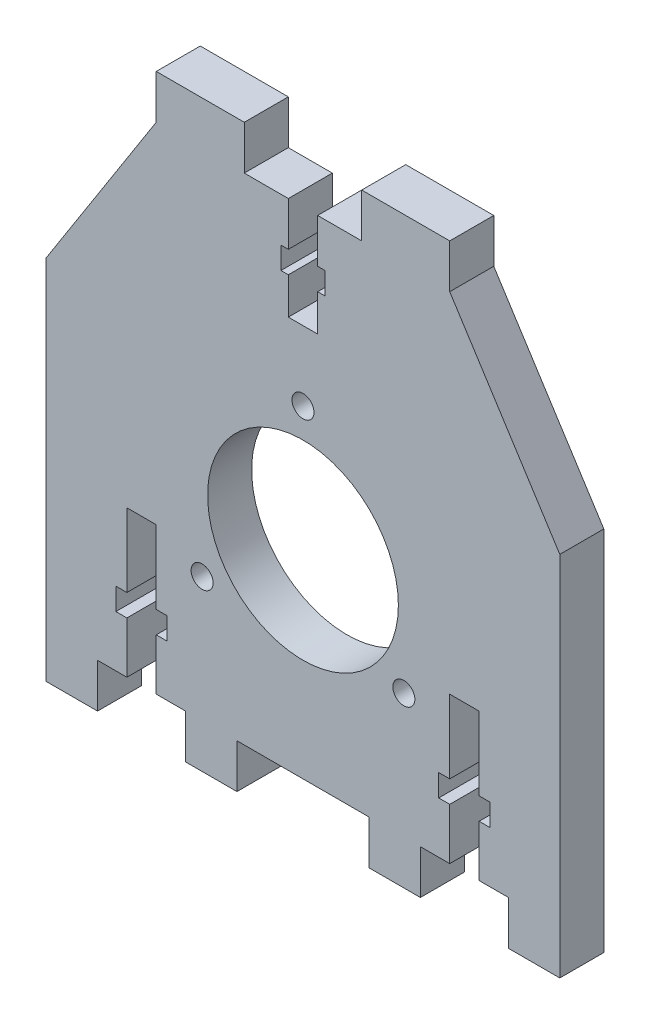
from build123d import *

# Parameters (mm, degrees)
ESQUISSE1_R             = 13
BOSS_EXTRU_1_DEPTH      = 6
ESQUISSE2_W             = 12
ESQUISSE2_H             = 6
BOSS_EXTRU_2_DEPTH      = 6
ESQUISSE3_R             = 1.5
ENL_V_MAT_EXTRU_1_DEPTH = 10
ENL_V_MAT_EXTRU_2_DEPTH = 10


with BuildPart() as part:
    # Esquisse1 → Boss.-Extru.1 (new body)
    with BuildSketch(Plane.XY):
        Polygon((55, 13), (53.5, 13), (53.5, 16), (55, 16), (55, 26), (59, 26), (59, 16), (60.5, 16), (60.5, 13), (59, 13), (59, 6), (63, 6), (63, 0), (70, 0), (70, 50), (55, 73.5), (15, 73.5), (0, 50), (0, 0), (7, 0), (7, 6), (11, 6), (11, 13), (9.5, 13), (9.5, 16), (11, 16), (11, 26), (15, 26), (15, 16), (16.5, 16), (16.5, 13), (15, 13), (15, 6), (19, 6), (19, 0), (26, 0), (26, 6), (44, 6), (44, 0), (51, 0), (51, 6), (55, 6), align=None)
        with Locations((35, 33)):
            Circle(ESQUISSE1_R, mode=Mode.SUBTRACT)
    extrude(amount=BOSS_EXTRU_1_DEPTH)

    # Esquisse2 → Boss.-Extru.2 (add)
    with BuildSketch(Plane(origin=(0, 73.5, 0), x_dir=(1, 0, 0), z_dir=(0, 1, 0))):
        with Locations((21, -3)):
            Rectangle(ESQUISSE2_W, ESQUISSE2_H)
        with Locations((49, -3)):
            Rectangle(ESQUISSE2_W, ESQUISSE2_H)
    extrude(amount=BOSS_EXTRU_2_DEPTH)

    # Esquisse3 → Enlèv. mat.-Extru.1 (cut)
    with BuildSketch(Plane.XY.offset(6)):
        with Locations((21.252272915, 23)):
            Circle(ESQUISSE3_R)
        with Locations((48.747727085, 23)):
            Circle(ESQUISSE3_R)
        with Locations((35, 50)):
            Circle(ESQUISSE3_R)
    extrude(amount=-ENL_V_MAT_EXTRU_1_DEPTH, mode=Mode.SUBTRACT)

    # Esquisse4 → Enlèv. mat.-Extru.2 (cut)
    with BuildSketch(Plane.XY.offset(6)):
        Polygon((33, 73.5), (37, 73.5), (37, 67.5), (38, 67.5), (38, 64.5), (37, 64.5), (37, 59.5), (33, 59.5), (33, 64.5), (32, 64.5), (32, 67.5), (33, 67.5), align=None)
    extrude(amount=-ENL_V_MAT_EXTRU_2_DEPTH, mode=Mode.SUBTRACT)


solid = part.part
